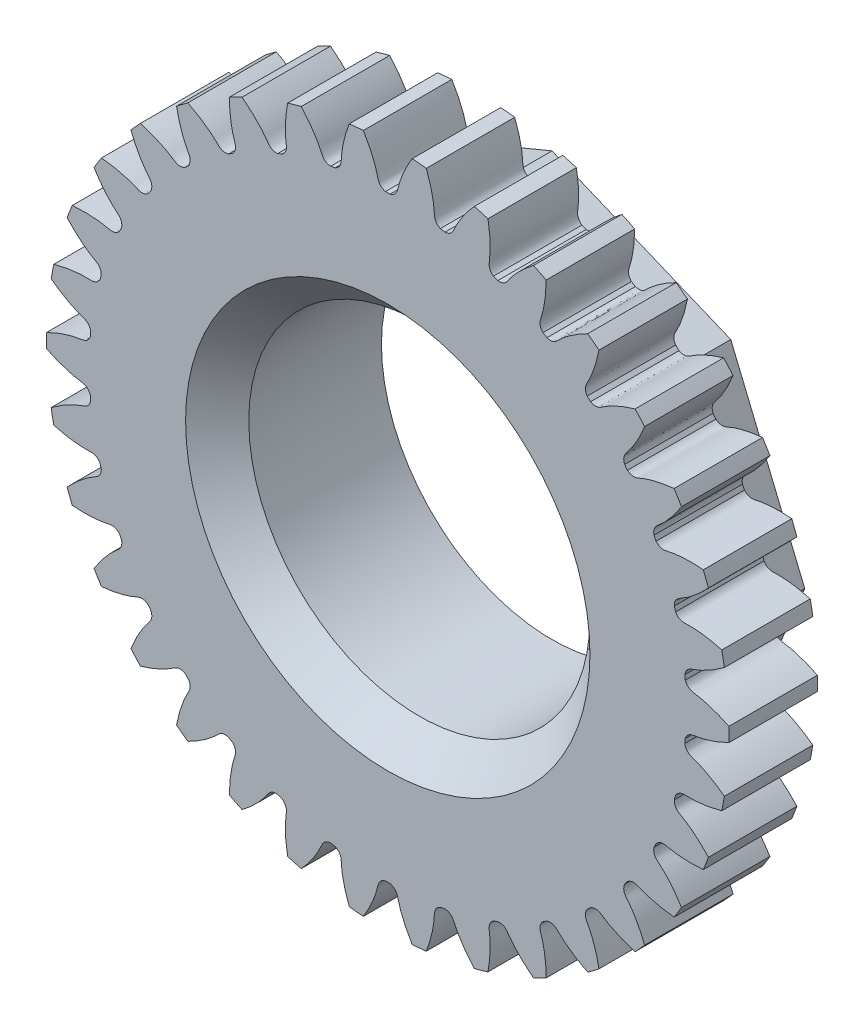
from build123d import *

# Parameters (mm, degrees)
SKETCH_1_R               = 27
EXTRUDE_1_DEPTH          = 7
CUT_EXTRUDE_1_DEPTH      = 39.820097888
PATTERN_CIRCULAR_1_COUNT = 34
SKETCH_4_R               = 13.5
CUT_EXTRUDE_2_DEPTH      = 39.771968992
CHAMFER_1_SIZE           = 2.5
EXTRUDE_START            = -7
SKETCH_5_R               = 13.5
EXTRUDE_2_DEPTH          = 6


with BuildPart() as part:
    # 草图1 → 凸台-拉伸1 (new body)
    with BuildSketch(Plane.XY):
        Circle(SKETCH_1_R)
    extrude(amount=EXTRUDE_1_DEPTH)

    # 草图2 → 切除-拉伸1 (cut, through all)
    with BuildSketch(Plane.XY):
        with BuildLine():
            ThreePointArc((0.183171175, 23.624289901), (0, 23.625), (-0.183171175, 23.624289901))
            add(Edge.make_bspline(
                [(-0.183171175, 23.624289901), (-0.716587806, 23.775112896), (-0.763410395, 24.188787315), (-0.879946356, 24.623629896), (-0.912930358, 24.738245821), (-0.951084244, 24.861314333), (-0.99469329, 24.992699977), (-1.044123655, 25.132221413), (-1.099711127, 25.279697341), (-1.161793992, 25.434932943), (-1.230702926, 25.597724076), (-1.306763614, 25.76785621), (-1.390295632, 25.945104927), (-1.481612426, 26.129235971), (-1.581020975, 26.320005435), (-1.688821555, 26.51715992), (-1.805307471, 26.720436707), (-1.930764813, 26.929563939), (-2.065472203, 27.144260803), (-2.209700557, 27.364237722), (-2.36371284, 27.589196551), (-2.527763841, 27.818830783), (-2.702099938, 28.052825758), (-2.886958877, 28.290858874), (-3.082569553, 28.532599812), (-3.289151799, 28.777710761), (-3.506916179, 29.025846649), (-3.73606378, 29.276655378), (-3.97678604, 29.52977807), (-4.229264468, 29.784849315), (-4.586391615, 30.131497572), (-4.865591808, 30.386500811), (-5.057363345, 30.554916542)],
                knots=[0, 0, 0, 0, 0.13072362, 0.143503881, 0.157401081, 0.17241522, 0.188546299, 0.205794316, 0.224159273, 0.243641169, 0.264240005, 0.285955779, 0.308788493, 0.332738146, 0.357804738, 0.383988269, 0.411288739, 0.439706149, 0.469240498, 0.499891786, 0.531660014, 0.56454518, 0.598547286, 0.633666331, 0.669902315, 0.707255238, 0.745725101, 0.785311903, 0.826015644, 0.867836324, 0.910773943, 1, 1, 1, 1], degree=3))
            ThreePointArc((-5.057363345, 30.554916542), (0, 30.970628811), (5.057363345, 30.554916542))
            add(Edge.make_bspline(
                [(0.183171175, 23.624289901), (0.716587806, 23.775112896), (0.763410395, 24.188787315), (0.879946356, 24.623629896), (0.912930358, 24.738245821), (0.951084244, 24.861314333), (0.99469329, 24.992699977), (1.044123655, 25.132221413), (1.099711127, 25.279697341), (1.161793992, 25.434932943), (1.230702926, 25.597724076), (1.306763614, 25.76785621), (1.390295632, 25.945104927), (1.481612426, 26.129235971), (1.581020975, 26.320005435), (1.688821555, 26.51715992), (1.805307471, 26.720436707), (1.930764813, 26.929563939), (2.065472203, 27.144260803), (2.209700557, 27.364237722), (2.36371284, 27.589196551), (2.527763841, 27.818830783), (2.702099938, 28.052825758), (2.886958877, 28.290858874), (3.082569553, 28.532599812), (3.289151799, 28.777710761), (3.506916179, 29.025846649), (3.73606378, 29.276655378), (3.97678604, 29.52977807), (4.229264468, 29.784849315), (4.586391615, 30.131497572), (4.865591808, 30.386500811), (5.057363345, 30.554916542)],
                knots=[0, 0, 0, 0, 0.13072362, 0.143503881, 0.157401081, 0.17241522, 0.188546299, 0.205794316, 0.224159273, 0.243641169, 0.264240005, 0.285955779, 0.308788493, 0.332738146, 0.357804738, 0.383988269, 0.411288739, 0.439706149, 0.469240498, 0.499891786, 0.531660014, 0.56454518, 0.598547286, 0.633666331, 0.669902315, 0.707255238, 0.745725101, 0.785311903, 0.826015644, 0.867836324, 0.910773943, 1, 1, 1, 1], degree=3))
        make_face()
    cut_extrude_1 = extrude(amount=CUT_EXTRUDE_1_DEPTH, mode=Mode.SUBTRACT)

    # 阵列(圆周)1: 切除-拉伸1 ×34 about axis
    pattern_circular_1_axis = Axis((0, 0, -1.5), (0, 0, 1))
    for i in range(1, PATTERN_CIRCULAR_1_COUNT):
        add(cut_extrude_1.rotate(pattern_circular_1_axis, i * 360 / PATTERN_CIRCULAR_1_COUNT), mode=Mode.SUBTRACT)

    # 草图4 → 切除-拉伸2 (cut, through all)
    with BuildSketch(Plane.XY.offset(7)):
        Circle(SKETCH_4_R)
    extrude(amount=-CUT_EXTRUDE_2_DEPTH, mode=Mode.SUBTRACT)

    # 倒角1
    chamfer_1_edges = [part.edges().sort_by_distance(p)[0] for p in [
        (-13.5, 0, 7),
    ]]
    chamfer(chamfer_1_edges, length=CHAMFER_1_SIZE)

    # 草图5 → 凸台-拉伸2 (add)
    with BuildSketch(Plane.XY.offset(7).offset(EXTRUDE_START)):
        Polygon((-14.142135624, 14.142135624), (-20, 0), (-14.142135624, -14.142135624), (0, -20), (14.142135624, -14.142135624), (20, 0), (14.142135624, 14.142135624), (0, 20), align=None)
        Circle(SKETCH_5_R, mode=Mode.SUBTRACT)
    extrude(amount=-EXTRUDE_2_DEPTH)


solid = part.part
